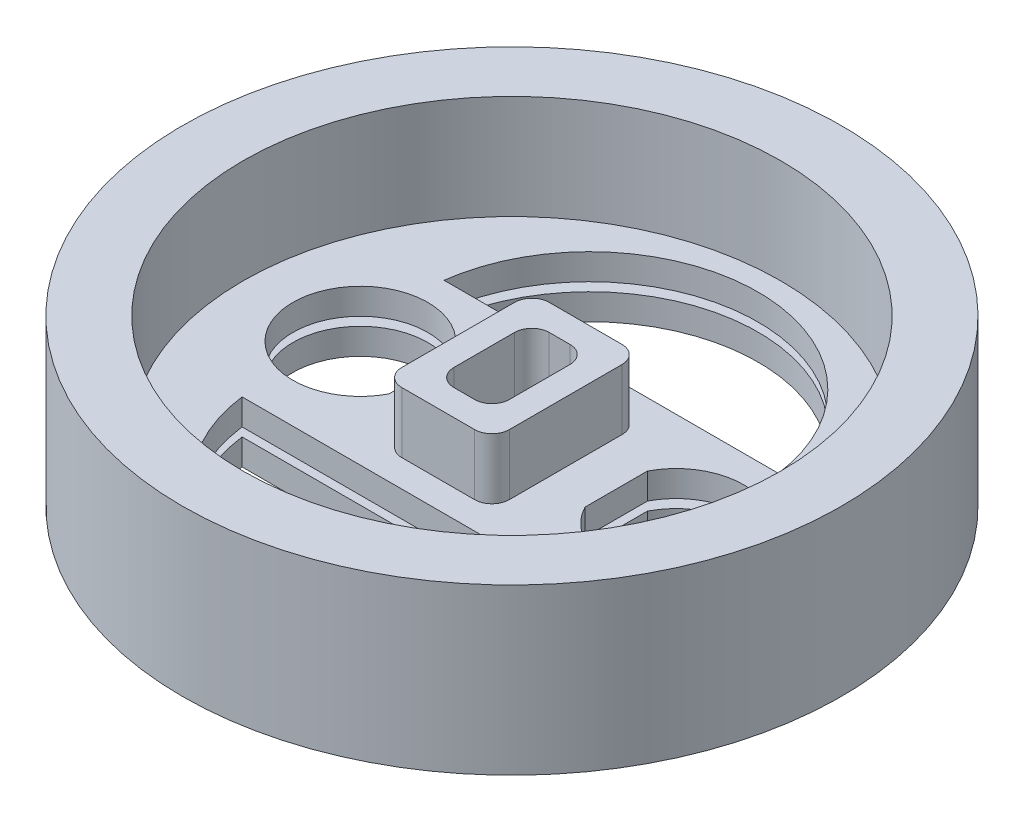
from build123d import *

# Parameters (mm, degrees)
SKETCH4_R           = 17
BOSS_EXTRUDE3_DEPTH = 6
SHELL4_T            = 0.5
SKETCH5_W           = 3.2
SKETCH5_H           = 5.5
BOSS_EXTRUDE4_DEPTH = 5
SHELL5_T            = 1.5
CUT_EXTRUDE2_DEPTH  = 69.741433184
FILLET1_R           = 1


with BuildPart() as part:
    # Sketch4 → Boss-Extrude3 (new body)
    with BuildSketch(Plane(origin=(0, 0, 0), x_dir=(1, 0, 0), z_dir=(0, 1, 0))):
        with Locations(Location((0, -46.79046007, 0), (0, 0, 270))):
            Circle(SKETCH4_R)
    extrude(amount=BOSS_EXTRUDE3_DEPTH)

    # Shell4
    shell4_openings = [part.faces().sort_by_distance(p)[0] for p in [
        (0, 6, 46.79046007),
    ]]
    offset(amount=SHELL4_T, openings=shell4_openings, kind=Kind.INTERSECTION)

    # Sketch5 → Boss-Extrude4 (add)
    with BuildSketch(Plane(origin=(0, 0, 0), x_dir=(1, 0, 0), z_dir=(0, 1, 0))):
        with Locations((0, -46.79046007)):
            Rectangle(SKETCH5_W, SKETCH5_H)
    extrude(amount=BOSS_EXTRUDE4_DEPTH)

    # Shell5
    shell5_openings = [part.faces().sort_by_distance(p)[0] for p in [
        (0, 5, 46.79046007),
    ]]
    offset(amount=SHELL5_T, openings=shell5_openings, kind=Kind.INTERSECTION)

    # Sketch8 → Cut-Extrude2 (cut, through all)
    with BuildSketch(Plane(origin=(0, 1.5, 0), x_dir=(1, 0, 0), z_dir=(0, 1, 0))):
        with BuildLine():
            Line((-9.736425903, -40.96944233), (9.535773011, -40.96944233))
            ThreePointArc((9.535773011, -40.96944233), (-0.100326446, -32.500466178), (-9.736425903, -40.96944233))
        make_face()
        with BuildLine():
            Line((-9.736425903, -52.61147781), (9.535773011, -52.61147781))
            ThreePointArc((9.535773011, -52.61147781), (-0.100326446, -61.080453963), (-9.736425903, -52.61147781))
        make_face()
        with BuildLine():
            Line((-5.651322976, -44.628261801), (-5.651322976, -48.229929487))
            ThreePointArc((-5.651322976, -48.229929487), (-12.990843168, -46.429095644), (-5.651322976, -44.628261801))
        make_face()
        with BuildLine():
            Line((5.651322976, -44.628261801), (5.651322976, -48.229929487))
            ThreePointArc((5.651322976, -48.229929487), (12.990843168, -46.429095644), (5.651322976, -44.628261801))
        make_face()
    extrude(amount=-CUT_EXTRUDE2_DEPTH, mode=Mode.SUBTRACT)

    # Fillet1
    fillet1_edges = [part.edges().sort_by_distance(p)[0] for p in [
        (3.1, 3.25, 51.04046007),
        (3.1, 3.25, 42.54046007),
        (-3.1, 3.25, 42.54046007),
        (-3.1, 3.25, 51.04046007),
        (1.6, 2.5, 49.54046007),
        (1.6, 2.5, 44.04046007),
        (-1.6, 2.5, 44.04046007),
        (-1.6, 2.5, 49.54046007),
    ]]
    fillet(fillet1_edges, radius=FILLET1_R)


solid = part.part
